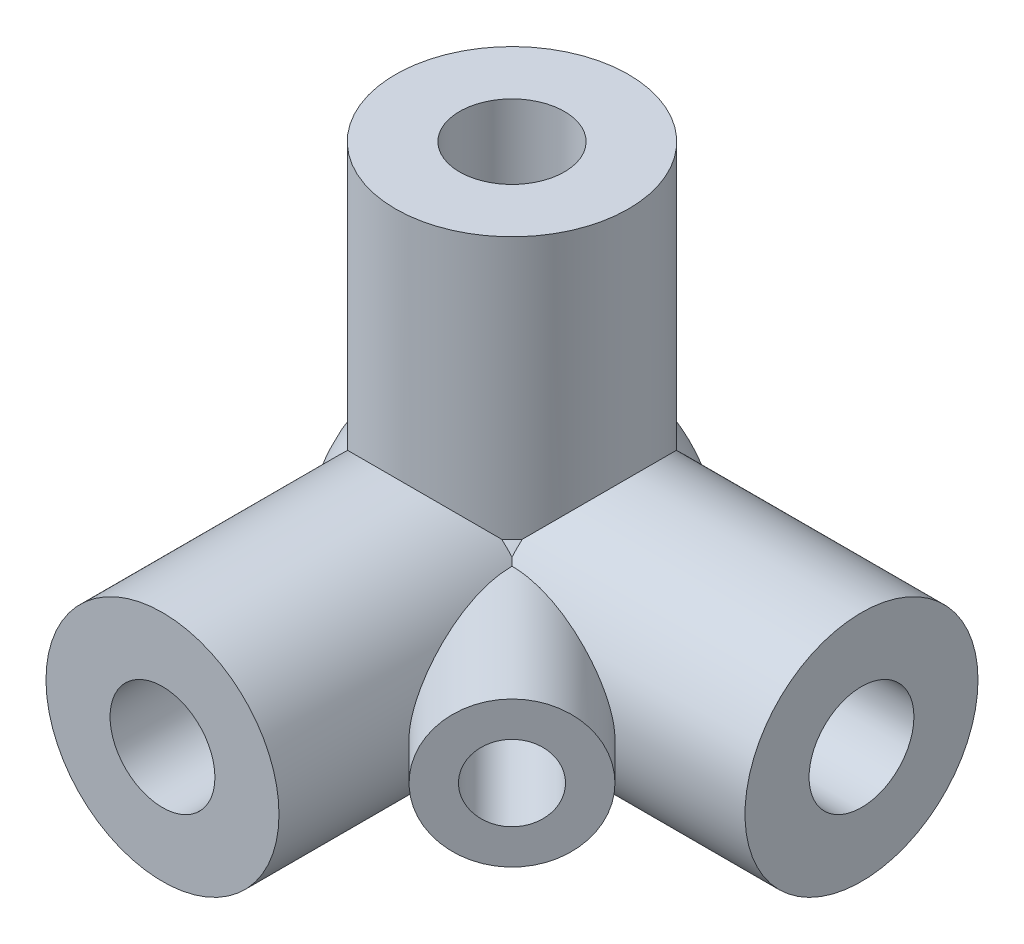
from build123d import *

# Parameters (mm, degrees)
SKETCH_2_R          = 2
EXTRUDE_1_DEPTH     = 6
SKETCH_3_R          = 2
EXTRUDE_2_DEPTH     = 6
SKETCH_4_R          = 2
EXTRUDE_3_DEPTH     = 6
SKETCH_6_R          = 0.9
CUT_EXTRUDE_1_DEPTH = 5
SKETCH_10_R         = 1.25
EXTRUDE_4_DEPTH     = 5
SKETCH_7_R          = 0.9
CUT_EXTRUDE_2_DEPTH = 5
SKETCH_8_R          = 0.9
CUT_EXTRUDE_3_DEPTH = 5
SKETCH_14_R         = 0.65
CUT_EXTRUDE_4_DEPTH = 3


with BuildPart() as part:
    # 草图2 → 凸台-拉伸1 (new body)
    with BuildSketch(Plane(origin=(0, 0, 0), x_dir=(1, 0, 0), z_dir=(0, 1, 0))):
        with Locations(Location((0, 0, 0), (0, 0, 270))):
            Circle(SKETCH_2_R)
    extrude(amount=EXTRUDE_1_DEPTH)

    # 草图3 → 凸台-拉伸2 (add)
    with BuildSketch(Plane.XY):
        Circle(SKETCH_3_R)
    extrude(amount=EXTRUDE_2_DEPTH)

    # 草图4 → 凸台-拉伸3 (add)
    with BuildSketch(Plane(origin=(0, 0, 0), x_dir=(0, 0, -1), z_dir=(1, 0, 0))):
        Circle(SKETCH_4_R)
    extrude(amount=EXTRUDE_3_DEPTH)

    # 草图5 → 旋转3 (revolve)
    with BuildSketch(Plane(origin=(0, 0, 0), x_dir=(1, 0, 0), z_dir=(0, 1, 0))):
        with BuildLine():
            Line((0, 2.5), (0, -2.5))
            ThreePointArc((0, -2.5), (-2.5, 0), (0, 2.5))
        make_face()
    revolve(axis=Axis((0, 0, -2.5), (0, 0, 1)))

    # 草图6 → 切除-拉伸1 (cut)
    with BuildSketch(Plane(origin=(0, 6, 0), x_dir=(1, 0, 0), z_dir=(0, 1, 0))):
        with Locations(Location((0, 0, 0), (0, 0, 270))):
            Circle(SKETCH_6_R)
    extrude(amount=-CUT_EXTRUDE_1_DEPTH, mode=Mode.SUBTRACT)

    # 草图10 → 凸台-拉伸4 (add)
    with BuildSketch(Plane(origin=(0, 0, 0), x_dir=(0.7071067811865461, 0, -0.707106781186549), z_dir=(0.707106781186549, 0, 0.7071067811865461))):
        with Locations(Location((0, 0, 0), (0, 0, 90.000016419))):
            Circle(SKETCH_10_R)
    extrude(amount=EXTRUDE_4_DEPTH)

    # 草图7 → 切除-拉伸2 (cut)
    with BuildSketch(Plane(origin=(6, 0, 0), x_dir=(0, 0, -1), z_dir=(1, 0, 0))):
        Circle(SKETCH_7_R)
    extrude(amount=-CUT_EXTRUDE_2_DEPTH, mode=Mode.SUBTRACT)

    # 草图8 → 切除-拉伸3 (cut)
    with BuildSketch(Plane.XY.offset(6)):
        Circle(SKETCH_8_R)
    extrude(amount=-CUT_EXTRUDE_3_DEPTH, mode=Mode.SUBTRACT)

    # 草图14 → 切除-拉伸4 (cut)
    with BuildSketch(Plane(origin=(3.535533906, 0, 3.535533906), x_dir=(0.7071067811865462, 0, -0.7071067811865489), z_dir=(0.7071067811865489, 0, 0.7071067811865462))):
        Circle(SKETCH_14_R)
    extrude(amount=-CUT_EXTRUDE_4_DEPTH, mode=Mode.SUBTRACT)


solid = part.part
